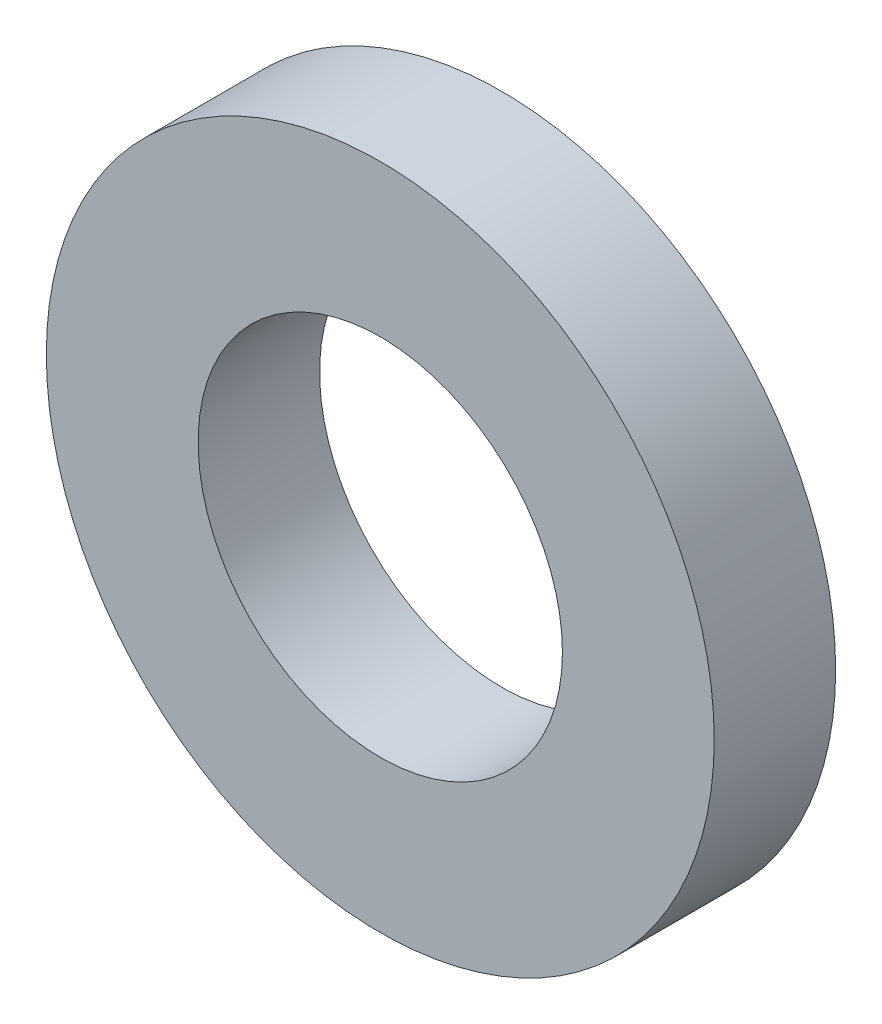
from build123d import *

# Parameters (mm, degrees)
SKETCH1_R           = 27.5
SKETCH1_R_2         = 15
BOSS_EXTRUDE1_DEPTH = 10


with BuildPart() as part:
    # Sketch1 → Boss-Extrude1 (new body)
    with BuildSketch(Plane.XY):
        Circle(SKETCH1_R)
        Circle(SKETCH1_R_2, mode=Mode.SUBTRACT)
    extrude(amount=BOSS_EXTRUDE1_DEPTH)


solid = part.part
